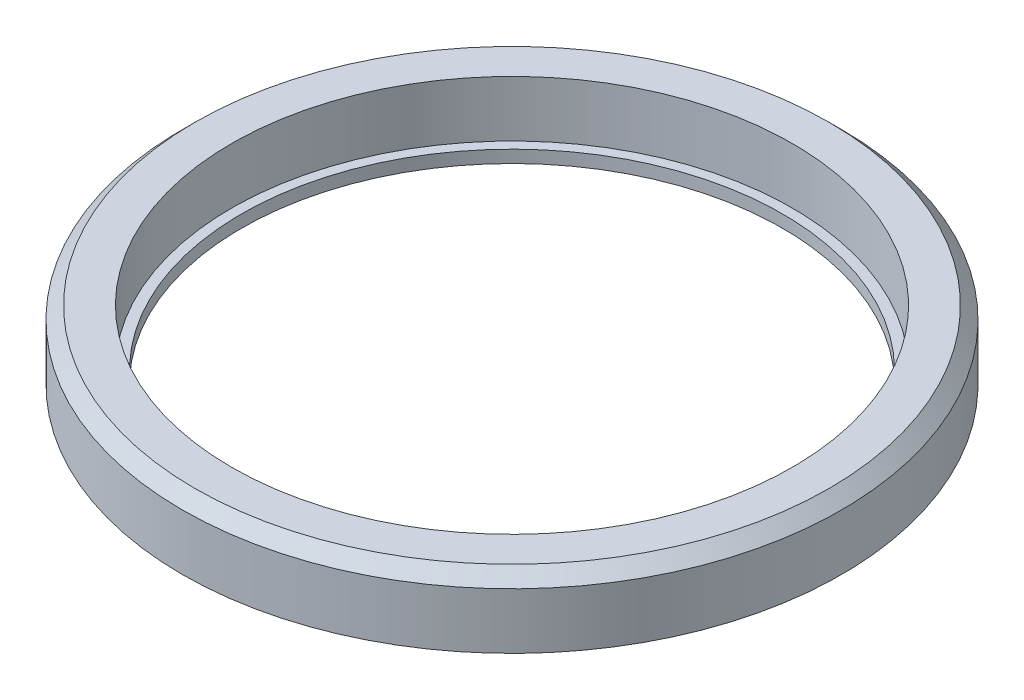
from build123d import *

# Parameters (mm, degrees)
SKETCH1_R           = 53
SKETCH1_R_2         = 43.5
BOSS_EXTRUDE1_DEPTH = 11
SKETCH2_R           = 45.1
CUT_EXTRUDE1_DEPTH  = 9
CHAMFER1_SIZE       = 2


with BuildPart() as part:
    # Sketch1 → Boss-Extrude1 (new body)
    with BuildSketch(Plane(origin=(0, 0, 0), x_dir=(1, 0, 0), z_dir=(0, 1, 0))):
        with Locations(Location((0, 0, 0), (0, 0, 270))):
            Circle(SKETCH1_R)
        with Locations(Location((0, 0, 0), (0, 0, 270))):
            Circle(SKETCH1_R_2, mode=Mode.SUBTRACT)
    extrude(amount=BOSS_EXTRUDE1_DEPTH)

    # Sketch2 → Cut-Extrude1 (cut)
    with BuildSketch(Plane(origin=(0, 11, 0), x_dir=(1, 0, 0), z_dir=(0, 1, 0))):
        with Locations(Location((0, 0, 0), (0, 0, 270))):
            Circle(SKETCH2_R)
    extrude(amount=-CUT_EXTRUDE1_DEPTH, mode=Mode.SUBTRACT)

    # Chamfer1
    chamfer1_edges = [part.edges().sort_by_distance(p)[0] for p in [
        (0, 11, -53),
    ]]
    chamfer(chamfer1_edges, length=CHAMFER1_SIZE)


solid = part.part
